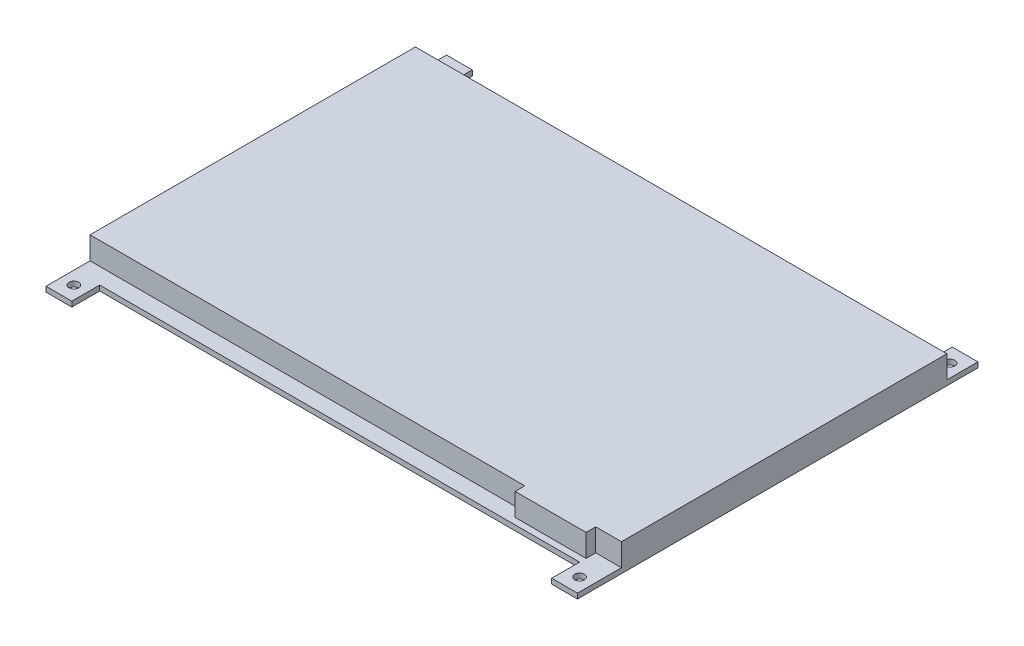
from build123d import *

# Parameters (mm, degrees)
SKETCH1_R           = 1.5
BOSS_EXTRUDE1_DEPTH = 1.6
BOSS_EXTRUDE2_DEPTH = 7


with BuildPart() as part:
    # Sketch1 → Boss-Extrude1 (new body)
    with BuildSketch(Plane(origin=(0, 0, 0), x_dir=(1, 0, 0), z_dir=(0, 1, 0))):
        Polygon((-167.387715517, 87.155002586), (-167.387715517, -19.804997414), (-167.387715517, -28.459997414), (-159.387715517, -28.459997414), (-159.387715517, -19.804997414), (-10.487715517, -19.804997414), (-10.487715517, -28.459997414), (-2.487715517, -28.459997414), (-2.487715517, -19.804997414), (-2.487715517, 87.155002586), (-2.487715517, 95.810002586), (-10.487715517, 95.810002586), (-10.487715517, 87.155002586), (-159.387715517, 87.155002586), (-159.387715517, 95.810002586), (-167.387715517, 95.810002586), align=None)
        with Locations(Location((-6.487715517, -23.804997414, 0), (0, 0, 270))):
            Circle(SKETCH1_R, mode=Mode.SUBTRACT)
        with Locations(Location((-163.387715517, -23.804997414, 0), (0, 0, 270))):
            Circle(SKETCH1_R, mode=Mode.SUBTRACT)
        with Locations(Location((-6.487715517, 91.155002586, 0), (0, 0, 90))):
            Circle(SKETCH1_R, mode=Mode.SUBTRACT)
        with Locations(Location((-163.387715517, 91.155002586, 0), (0, 0, 90))):
            Circle(SKETCH1_R, mode=Mode.SUBTRACT)
    extrude(amount=BOSS_EXTRUDE1_DEPTH)

    # Sketch2 → Boss-Extrude2 (add)
    with BuildSketch(Plane(origin=(0, 1.6, 0), x_dir=(1, 0, 0), z_dir=(0, 1, 0))):
        Polygon((-167.387715517, 86.155002586), (-2.487715517, 86.155002586), (-2.487715517, -14.804997414), (-10.487715517, -14.804997414), (-10.487715517, -17.804997414), (-32.487715517, -17.804997414), (-32.487715517, -14.804997414), (-167.387715517, -14.804997414), align=None)
    extrude(amount=BOSS_EXTRUDE2_DEPTH)


solid = part.part
